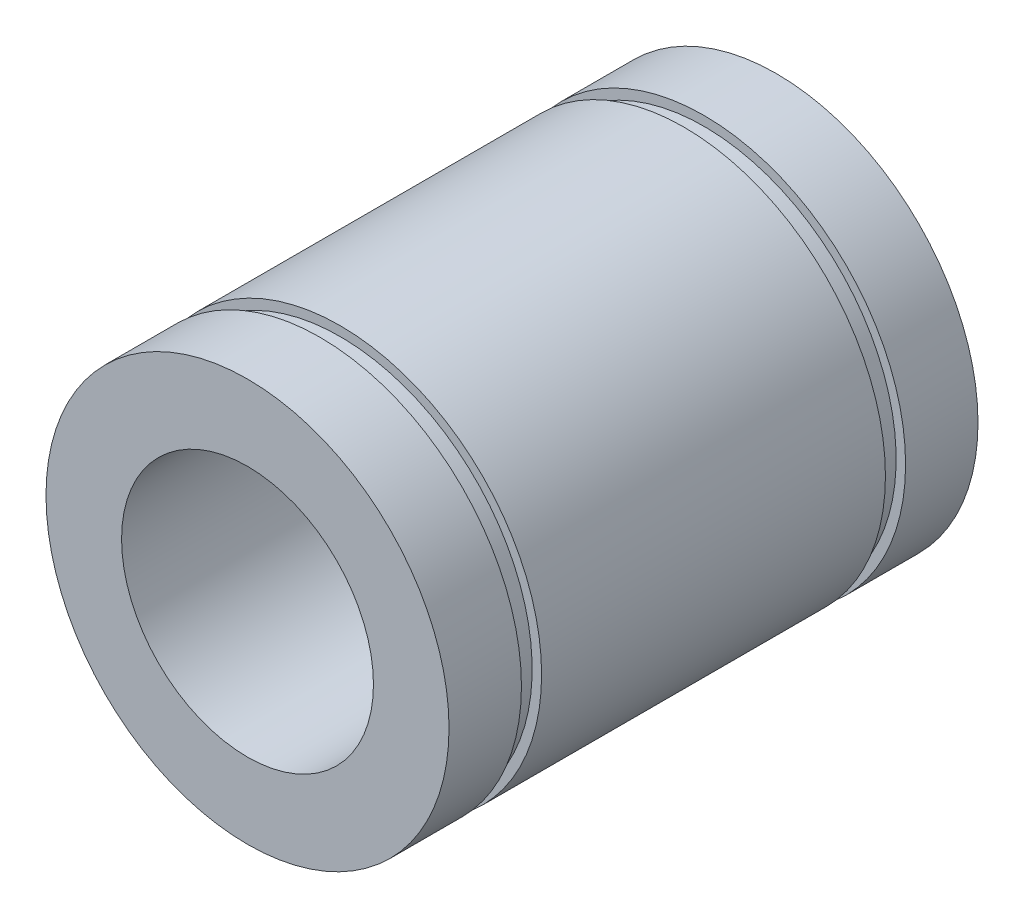
from build123d import *


with BuildPart() as part:
    # 草图1 → 旋转1 (revolve)
    with BuildSketch(Plane(origin=(0, 0, 0), x_dir=(0, 0, 1), z_dir=(0, -1, 0))):
        Polygon((0, 10), (42, 10), (42, 16), (36.25, 16), (36.25, 15.25), (34.65, 15.25), (34.65, 16), (7.35, 16), (7.35, 15.25), (5.75, 15.25), (5.75, 16), (0, 16), align=None)
    revolve(axis=Axis((0, 0, 0), (0, 0, 1)))


solid = part.part
